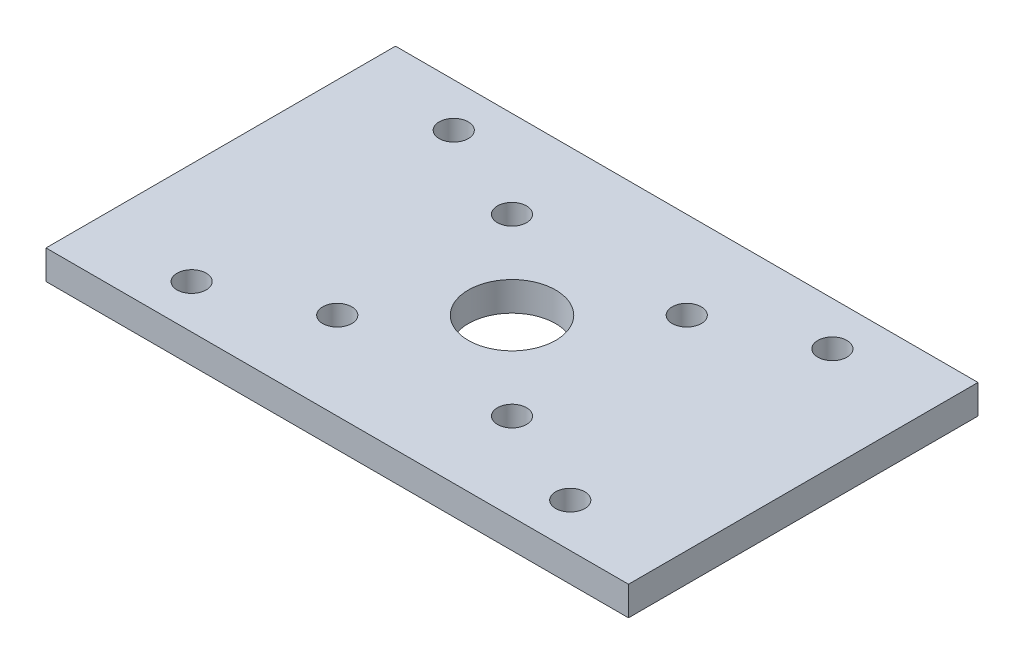
from build123d import *

# Parameters (mm, degrees)
SKETCH1_W           = 127
SKETCH1_H           = 76.2
BOSS_EXTRUDE1_DEPTH = 6.35
SKETCH2_R           = 3.175
SKETCH2_R_2         = 9.525
CUT_EXTRUDE1_DEPTH  = 75.324844433


with BuildPart() as part:
    # Sketch1 → Boss-Extrude1 (new body)
    with BuildSketch(Plane(origin=(0, 0, 0), x_dir=(1, 0, 0), z_dir=(0, 1, 0))):
        Rectangle(SKETCH1_W, SKETCH1_H)
    extrude(amount=BOSS_EXTRUDE1_DEPTH)

    # Sketch2 → Cut-Extrude1 (cut, through all)
    with BuildSketch(Plane(origin=(0, 6.35, 0), x_dir=(1, 0, 0), z_dir=(0, 1, 0))):
        with Locations(Location((-41.275, 28.575, 0), (0, 0, 270))):
            Circle(SKETCH2_R)
        with Locations(Location((41.275, 28.575, 0), (0, 0, 270))):
            Circle(SKETCH2_R)
        with Locations(Location((41.275, -28.575, 0), (0, 0, 270))):
            Circle(SKETCH2_R)
        with Locations(Location((-41.275, -28.575, 0), (0, 0, 270))):
            Circle(SKETCH2_R)
        with Locations(Location((-19.05, 19.05, 0), (0, 0, 270))):
            Circle(SKETCH2_R)
        with Locations(Location((19.05, 19.05, 0), (0, 0, 270))):
            Circle(SKETCH2_R)
        with Locations(Location((19.05, -19.05, 0), (0, 0, 270))):
            Circle(SKETCH2_R)
        with Locations(Location((-19.05, -19.05, 0), (0, 0, 270))):
            Circle(SKETCH2_R)
        with Locations(Location((0, 0, 0), (0, 0, 270))):
            Circle(SKETCH2_R_2)
    extrude(amount=-CUT_EXTRUDE1_DEPTH, mode=Mode.SUBTRACT)


solid = part.part
